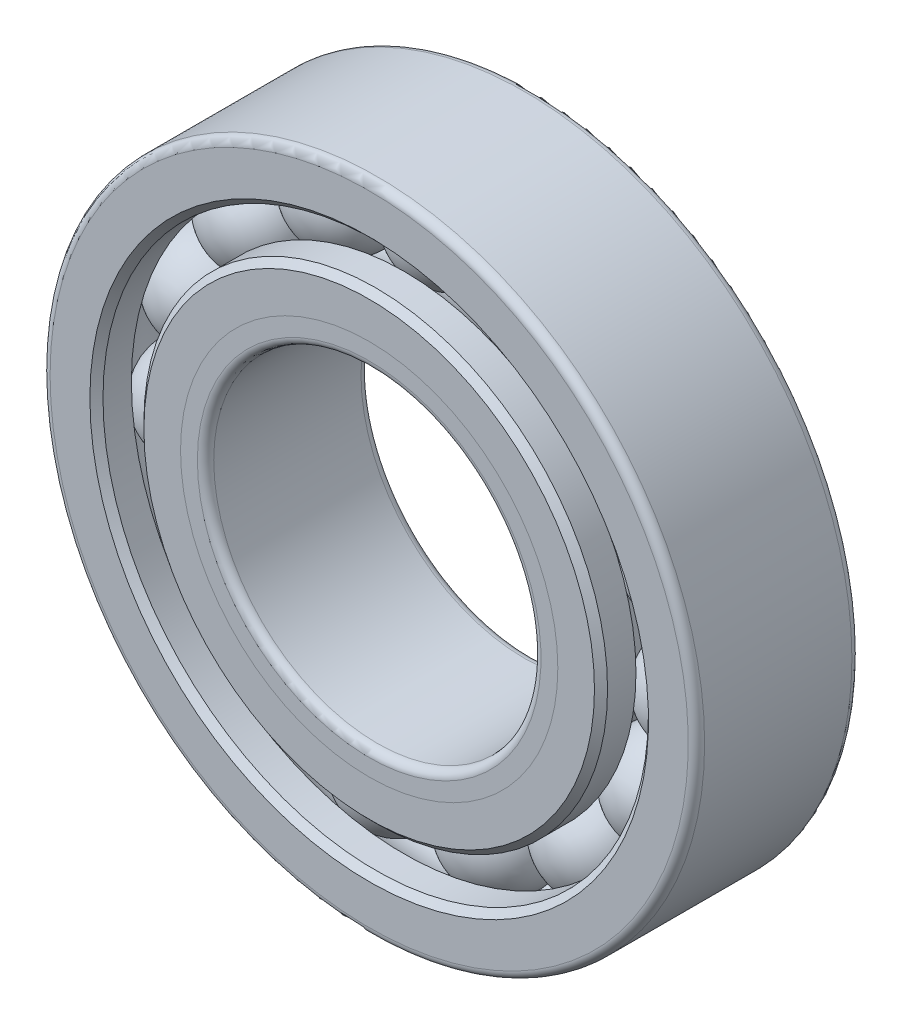
from build123d import *

# Parameters (mm, degrees)
SKETCH3_W              = 12.7
SKETCH3_H              = 5.29336
SKETCH3_H_2            = 4.23164
SKETCH4_R              = 3.96875
CIRPATTERN1_COUNT      = 15
FILLET1_R              = 0.635
FILLET2_R              = 0.635
CHAMFER1_SIZE          = 0.508
CHAMFER2_SIZE          = 0.508
SPLIT1_SURFACE_1_BACK  = 73.956
SPLIT1_SURFACE_1_DEPTH = 147.912
SPLIT1_SURFACE_2_BACK  = 73.956
SPLIT1_SURFACE_2_DEPTH = 147.912


with BuildPart() as part:
    # Sketch3 → Revolve2 (revolve)
    with BuildSketch(Plane(origin=(0, 0, 0), x_dir=(0, 0, -1), z_dir=(1, 0, 0)), mode=Mode.PRIVATE) as revolve2_sk:
        with Locations((0, 15.34668)):
            Rectangle(SKETCH3_W, SKETCH3_H)
        with Locations((0, 23.28418)):
            Rectangle(SKETCH3_W, SKETCH3_H_2)
    revolve(revolve2_sk.sketch.rotate(Axis((0, 0, 6.35), (0, 0, -1)), 90), axis=Axis((0, 0, 6.35), (0, 0, -1)))

    # Sketch4 → Cut-Revolve1 (revolve, cut)
    with BuildSketch(Plane(origin=(0, 0, 0), x_dir=(0, 0, -1), z_dir=(1, 0, 0)), mode=Mode.PRIVATE) as cut_revolve1_sk:
        with Locations((0, 19.58086)):
            Circle(SKETCH4_R)
    revolve(cut_revolve1_sk.sketch.rotate(Axis((0, 0, 6.35), (0, 0, -1)), 90), axis=Axis((0, 0, 6.35), (0, 0, -1)), mode=Mode.SUBTRACT)

    # Fillet1
    fillet1_edges = [part.edges().sort_by_distance(p)[0] for p in [
        (-25.4, 0, -6.35),
        (-25.4, 0, 6.35),
    ]]
    fillet(fillet1_edges, radius=FILLET1_R)

    # Fillet2
    fillet2_edges = [part.edges().sort_by_distance(p)[0] for p in [
        (-12.7, 0, 6.35),
        (-12.7, 0, -6.35),
    ]]
    fillet(fillet2_edges, radius=FILLET2_R)

    # Chamfer1
    chamfer1_edges = [part.edges().sort_by_distance(p)[0] for p in [
        (-21.16836, 0, -6.35),
        (-21.16836, 0, 6.35),
    ]]
    chamfer(chamfer1_edges, length=CHAMFER1_SIZE)

    # Chamfer2
    chamfer2_edges = [part.edges().sort_by_distance(p)[0] for p in [
        (-17.99336, 0, 6.35),
        (-17.99336, 0, -6.35),
    ]]
    chamfer(chamfer2_edges, length=CHAMFER2_SIZE)


with BuildPart() as body_2:
    # Sketch5 → Revolve3 (revolve)
    with BuildSketch(Plane(origin=(0, 0, 0), x_dir=(0, 0, -1), z_dir=(1, 0, 0))):
        with BuildLine():
            Line((-3.96875, 19.58086), (3.96875, 19.58086))
            ThreePointArc((3.96875, 19.58086), (0, 23.54961), (-3.96875, 19.58086))
        make_face()
    revolve(axis=Axis((0, 19.58086, 3.96875), (0, 0, -1)))


with BuildPart() as cirpattern1_1:
    # CirPattern1: pattern copy
    add(body_2.part.rotate(Axis((0, 0, 0), (0, 0, 1)), 1 * 360 / CIRPATTERN1_COUNT))


with BuildPart() as cirpattern1_2:
    # CirPattern1: pattern copy
    add(body_2.part.rotate(Axis((0, 0, 0), (0, 0, 1)), 2 * 360 / CIRPATTERN1_COUNT))


with BuildPart() as cirpattern1_3:
    # CirPattern1: pattern copy
    add(body_2.part.rotate(Axis((0, 0, 0), (0, 0, 1)), 3 * 360 / CIRPATTERN1_COUNT))


with BuildPart() as cirpattern1_4:
    # CirPattern1: pattern copy
    add(body_2.part.rotate(Axis((0, 0, 0), (0, 0, 1)), 4 * 360 / CIRPATTERN1_COUNT))


with BuildPart() as cirpattern1_5:
    # CirPattern1: pattern copy
    add(body_2.part.rotate(Axis((0, 0, 0), (0, 0, 1)), 5 * 360 / CIRPATTERN1_COUNT))


with BuildPart() as cirpattern1_6:
    # CirPattern1: pattern copy
    add(body_2.part.rotate(Axis((0, 0, 0), (0, 0, 1)), 6 * 360 / CIRPATTERN1_COUNT))


with BuildPart() as cirpattern1_7:
    # CirPattern1: pattern copy
    add(body_2.part.rotate(Axis((0, 0, 0), (0, 0, 1)), 7 * 360 / CIRPATTERN1_COUNT))


with BuildPart() as cirpattern1_8:
    # CirPattern1: pattern copy
    add(body_2.part.rotate(Axis((0, 0, 0), (0, 0, 1)), 8 * 360 / CIRPATTERN1_COUNT))


with BuildPart() as cirpattern1_9:
    # CirPattern1: pattern copy
    add(body_2.part.rotate(Axis((0, 0, 0), (0, 0, 1)), 9 * 360 / CIRPATTERN1_COUNT))


with BuildPart() as cirpattern1_10:
    # CirPattern1: pattern copy
    add(body_2.part.rotate(Axis((0, 0, 0), (0, 0, 1)), 10 * 360 / CIRPATTERN1_COUNT))


with BuildPart() as cirpattern1_11:
    # CirPattern1: pattern copy
    add(body_2.part.rotate(Axis((0, 0, 0), (0, 0, 1)), 11 * 360 / CIRPATTERN1_COUNT))


with BuildPart() as cirpattern1_12:
    # CirPattern1: pattern copy
    add(body_2.part.rotate(Axis((0, 0, 0), (0, 0, 1)), 12 * 360 / CIRPATTERN1_COUNT))


with BuildPart() as cirpattern1_13:
    # CirPattern1: pattern copy
    add(body_2.part.rotate(Axis((0, 0, 0), (0, 0, 1)), 13 * 360 / CIRPATTERN1_COUNT))


with BuildPart() as cirpattern1_14:
    # CirPattern1: pattern copy
    add(body_2.part.rotate(Axis((0, 0, 0), (0, 0, 1)), 14 * 360 / CIRPATTERN1_COUNT))


with BuildPart() as body_17:
    # Split1: the piece behind the surface
    add(part.part)
    # Split1 surface: a surface, the sketch's curves swept straight by 147.912 mm
    with BuildLine(Plane.XY.offset(-SPLIT1_SURFACE_1_BACK), mode=Mode.PRIVATE) as split1_surface_1_path:
        CenterArc((0, 0), 14.641406667, 0, 360)
    split1_surface_1 = Shell.extrude(split1_surface_1_path.wire(), (0 * SPLIT1_SURFACE_1_DEPTH, 0 * SPLIT1_SURFACE_1_DEPTH, 1 * SPLIT1_SURFACE_1_DEPTH))
    split(bisect_by=split1_surface_1, keep=Keep.BOTTOM)


with BuildPart() as part_1:
    add(part.part)

    # Split1: split by a surface, the side it looks to stays
    # Split1 surface: a surface, the sketch's curves swept straight by 147.912 mm
    with BuildLine(Plane.XY.offset(-SPLIT1_SURFACE_2_BACK), mode=Mode.PRIVATE) as split1_surface_2_path:
        CenterArc((0, 0), 14.641406667, 0, 360)
    split1_surface_2 = Shell.extrude(split1_surface_2_path.wire(), (0 * SPLIT1_SURFACE_2_DEPTH, 0 * SPLIT1_SURFACE_2_DEPTH, 1 * SPLIT1_SURFACE_2_DEPTH))
    split(bisect_by=split1_surface_2, keep=Keep.TOP)


solid = Compound([body_2.part, cirpattern1_1.part, cirpattern1_2.part, cirpattern1_3.part, cirpattern1_4.part, cirpattern1_5.part, cirpattern1_6.part, cirpattern1_7.part, cirpattern1_8.part, cirpattern1_9.part, cirpattern1_10.part, cirpattern1_11.part, cirpattern1_12.part, cirpattern1_13.part, cirpattern1_14.part, body_17.part, part_1.part])
